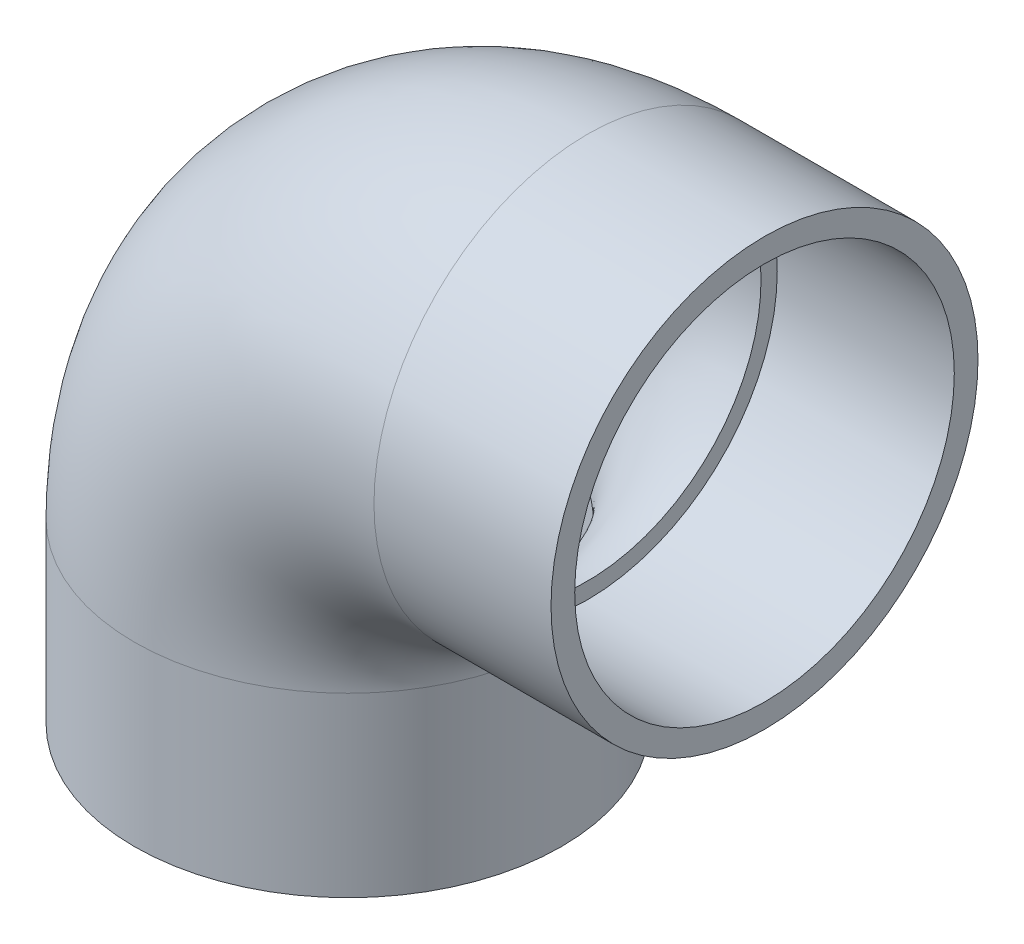
from build123d import *

# Parameters (mm, degrees)
CROQUIS2_R            = 123
CROQUIS2_R_2          = 100
CORTAR_EXTRUIR1_START = -102
CROQUIS3_R            = 109.35
CROQUIS3_R_2          = 100
CORTAR_EXTRUIR1_DEPTH = 102
CROQUIS4_R            = 109.35
CROQUIS4_R_2          = 100
CORTAR_EXTRUIR2_DEPTH = 102


with BuildPart() as part:
    # Barrer1: sweep along a path in Croquis1
    with BuildLine(Plane.XY) as barrer1_path:
        Line((0, 0), (0, 102))
        ThreePointArc((0, 102), (40.419264196, 199.580735804), (138, 240))
        Line((138, 240), (240, 240))
    # Croquis2 → Barrer1 (sweep)
    with BuildSketch(Plane(origin=(0, 0, 0), x_dir=(1, 0, 0), z_dir=(0, 1, 0))):
        Circle(CROQUIS2_R)
        Circle(CROQUIS2_R_2, mode=Mode.SUBTRACT)
    sweep(path=barrer1_path.line)

    # Croquis3 → Cortar-Extruir1 (cut)
    with BuildSketch(Plane.XZ.offset(CORTAR_EXTRUIR1_START)):
        with Locations(Location((0, 0, 0), (0, 0, 270))):
            Circle(CROQUIS3_R)
        Circle(CROQUIS3_R_2, mode=Mode.SUBTRACT)
    extrude(amount=CORTAR_EXTRUIR1_DEPTH, mode=Mode.SUBTRACT)

    # Croquis4 → Cortar-Extruir2 (cut)
    with BuildSketch(Plane(origin=(240, 0, 0), x_dir=(0, 0, -1), z_dir=(1, 0, 0))):
        with Locations(Location((0, 240, 0), (0, 0, 90))):
            Circle(CROQUIS4_R)
        with Locations((0, 240)):
            Circle(CROQUIS4_R_2, mode=Mode.SUBTRACT)
    extrude(amount=-CORTAR_EXTRUIR2_DEPTH, mode=Mode.SUBTRACT)


solid = part.part
